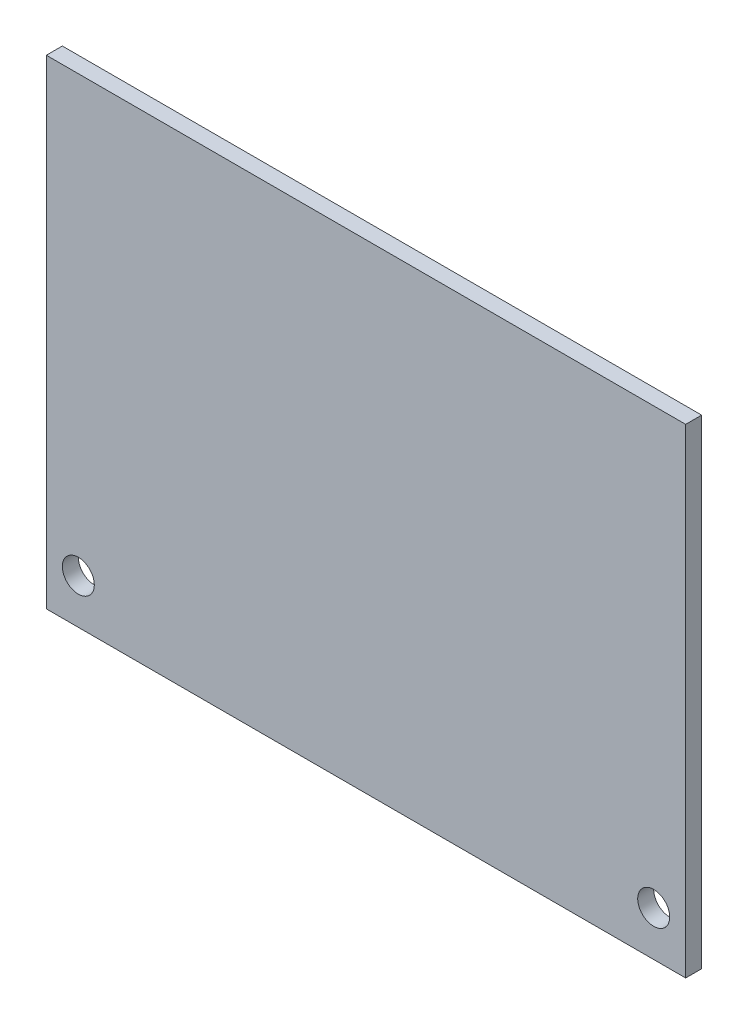
from build123d import *

# Parameters (mm, degrees)
SKICA1_W                 = 40
SKICA1_H                 = 30
P_IDAT_VYSUNUT_M1_DEPTH  = 1
SKICA2_R                 = 1
ODEBRAT_VYSUNUT_M1_DEPTH = 1


with BuildPart() as part:
    # Skica1 → Přidat vysunutím1 (new body)
    with BuildSketch(Plane.XY):
        Rectangle(SKICA1_W, SKICA1_H)
    extrude(amount=P_IDAT_VYSUNUT_M1_DEPTH)

    # Skica2 → Odebrat vysunutím1 (cut)
    with BuildSketch(Plane.XY.offset(1)):
        with Locations((18, -12.2)):
            Circle(SKICA2_R)
        with Locations((-18, -12.2)):
            Circle(SKICA2_R)
    extrude(amount=-ODEBRAT_VYSUNUT_M1_DEPTH, mode=Mode.SUBTRACT)


solid = part.part
